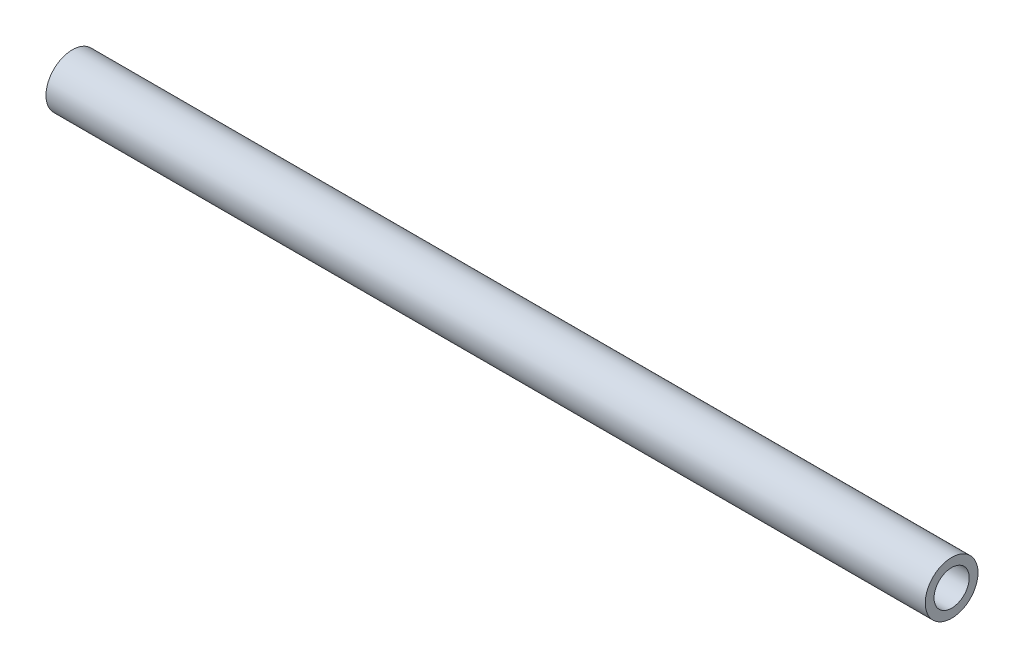
from build123d import *

# Parameters (mm, degrees)
SKETCH1_R           = 3
SKETCH1_R_2         = 2
BOSS_EXTRUDE1_DEPTH = 50


with BuildPart() as part:
    # Sketch1 → Boss-Extrude1 (new, symmetric)
    with BuildSketch(Plane(origin=(0, 0, 0), x_dir=(0, 0, -1), z_dir=(1, 0, 0))):
        Circle(SKETCH1_R)
        Circle(SKETCH1_R_2, mode=Mode.SUBTRACT)
    extrude(amount=BOSS_EXTRUDE1_DEPTH, both=True)


solid = part.part
